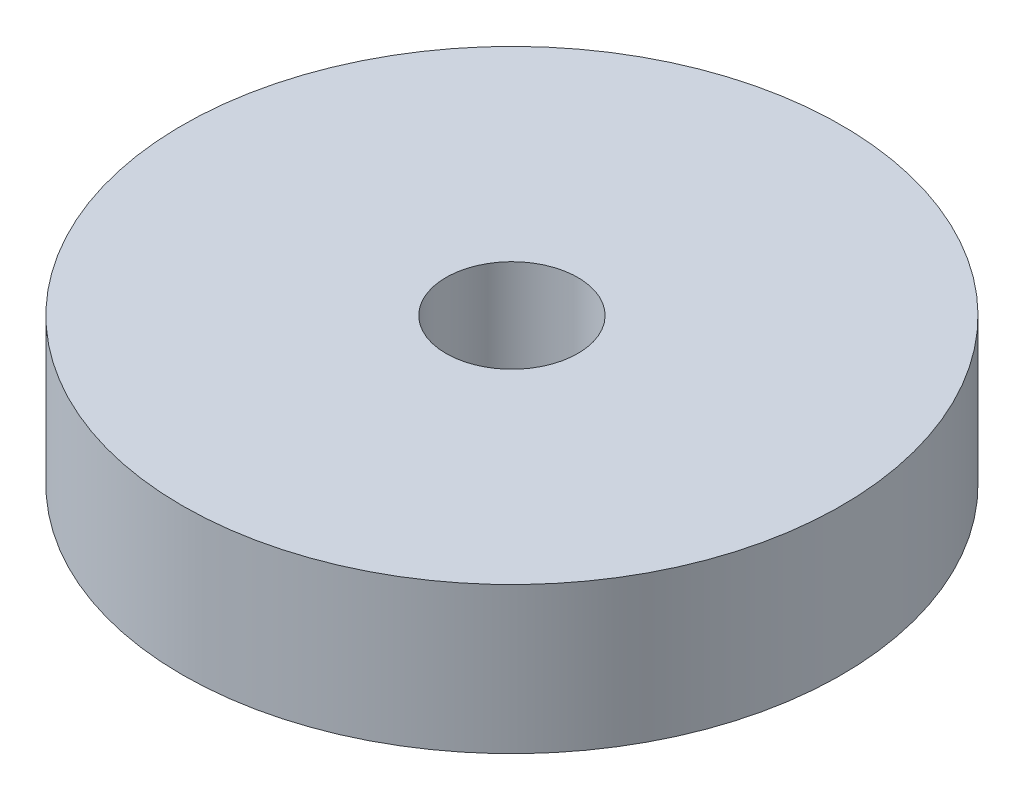
from build123d import *

# Parameters (mm, degrees)
SKETCH1_R           = 4.5
BOSS_EXTRUDE1_DEPTH = 2
SKETCH2_R           = 0.9
CUT_EXTRUDE1_DEPTH  = 2


with BuildPart() as part:
    # Sketch1 → Boss-Extrude1 (new body)
    with BuildSketch(Plane(origin=(0, 0, 0), x_dir=(1, 0, 0), z_dir=(0, 1, 0))):
        with Locations(Location((78.051936378, -71.452673496, 0), (0, 0, 270))):
            Circle(SKETCH1_R)
    extrude(amount=BOSS_EXTRUDE1_DEPTH)

    # Sketch2 → Cut-Extrude1 (cut)
    with BuildSketch(Plane(origin=(0, 2, 0), x_dir=(1, 0, 0), z_dir=(0, 1, 0))):
        with Locations(Location((78.051936378, -71.452673496, 0), (0, 0, 270))):
            Circle(SKETCH2_R)
    extrude(amount=-CUT_EXTRUDE1_DEPTH, mode=Mode.SUBTRACT)


solid = part.part
